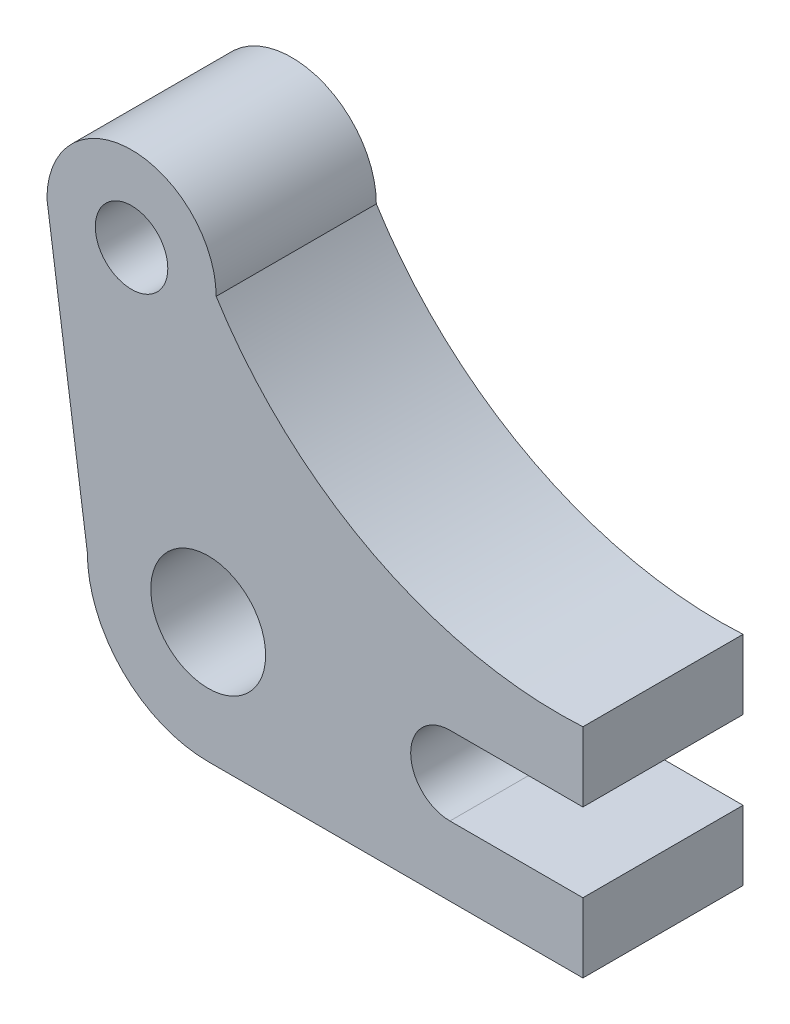
from build123d import *

# Parameters (mm, degrees)
SKETCH1_R           = 6
SKETCH1_R_2         = 20
SKETCH1_R_3         = 9.5
BOSS_EXTRUDE1_DEPTH = 26.5


with BuildPart() as part:
    # Sketch1 → Boss-Extrude1 (new body)
    # profile 1 of 3: a face of its own
    with BuildSketch(Plane.XY):
        with BuildLine():
            ThreePointArc((1.31786679, 47.330365488), (-10.725012101, 33.46783769), (-26.134944205, 43.454558949))
            Line((-26.134944205, 43.454558949), (-20, 0))
            ThreePointArc((-20, 0), (0, 20), (20, 0))
            ThreePointArc((20, 0), (14.142135624, -14.142135624), (0, -20))
            Line((0, -20), (62, -20))
            Line((62, -20), (62, -8.5))
            Line((62, -8.5), (40, -8.5))
            ThreePointArc((40, -8.5), (33.5, -2), (40, 4.5))
            Line((40, 4.5), (62, 4.5))
            Line((62, 4.5), (62, 16))
            ThreePointArc((62, 16), (27.367488456, 23.353309282), (1.31786679, 47.330365488))
        make_face()
    # profile 2 of 3: a face of its own
    with BuildSketch(Plane.XY):
        with BuildLine():
            ThreePointArc((1.31786679, 47.330365488), (-12.68213321, 61.330365488), (-26.68213321, 47.330365488))
            Line((-26.68213321, 47.330365488), (-26.134944205, 43.454558949))
            ThreePointArc((-26.134944205, 43.454558949), (-10.725012101, 33.46783769), (1.31786679, 47.330365488))
        make_face()
        with Locations((-12.68213321, 47.330365488)):
            Circle(SKETCH1_R, mode=Mode.SUBTRACT)
    # profile 3 of 3: a face of its own
    with BuildSketch(Plane.XY):
        Circle(SKETCH1_R_2)
        Circle(SKETCH1_R_3, mode=Mode.SUBTRACT)
    extrude(amount=BOSS_EXTRUDE1_DEPTH)


solid = part.part
